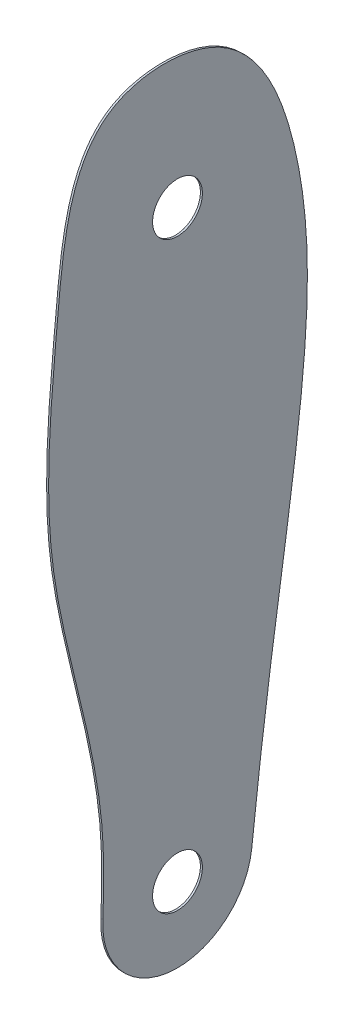
from build123d import *

# Parameters (mm, degrees)
SKETCH5_R      = 12.5
EXTRUDE1_DEPTH = 0.5


with BuildPart() as part:
    # Sketch5 → Extrude1 (new, symmetric)
    with BuildSketch(Plane(origin=(0, 0, 0), x_dir=(0, 0, -1), z_dir=(1, 0, 0))):
        with BuildLine():
            ThreePointArc((-37.433305448, -290.764459076), (-3.156466147, -330.36692015), (37.27788192, -297.075477828))
            add(Edge.make_bspline(
                [(37.27788192, -297.075477828), (40.284097437, -269.578003476), (48.374374926, -206.90287994), (64.643617708, -109.504452761), (68.209091464, -15.666206655), (34.636335448, 68.123712269), (-52.062645711, 67.180777503), (-61.362785151, -30.567418603), (-70.928245145, -131.055654485), (-35.697966853, -222.609182538), (-37.084798397, -278.999108272), (-37.433305448, -290.764459076)],
                knots=[0, 0, 0, 0, 0.106321264, 0.242882868, 0.375994978, 0.475518513, 0.539537242, 0.641839757, 0.780820508, 0.952014366, 0.997141788, 0.997141788, 0.997141788, 0.997141788], degree=3))
        make_face()
        with Locations((0, -293)):
            Circle(SKETCH5_R, mode=Mode.SUBTRACT)
        Circle(SKETCH5_R, mode=Mode.SUBTRACT)
    extrude(amount=EXTRUDE1_DEPTH, both=True)


solid = part.part
